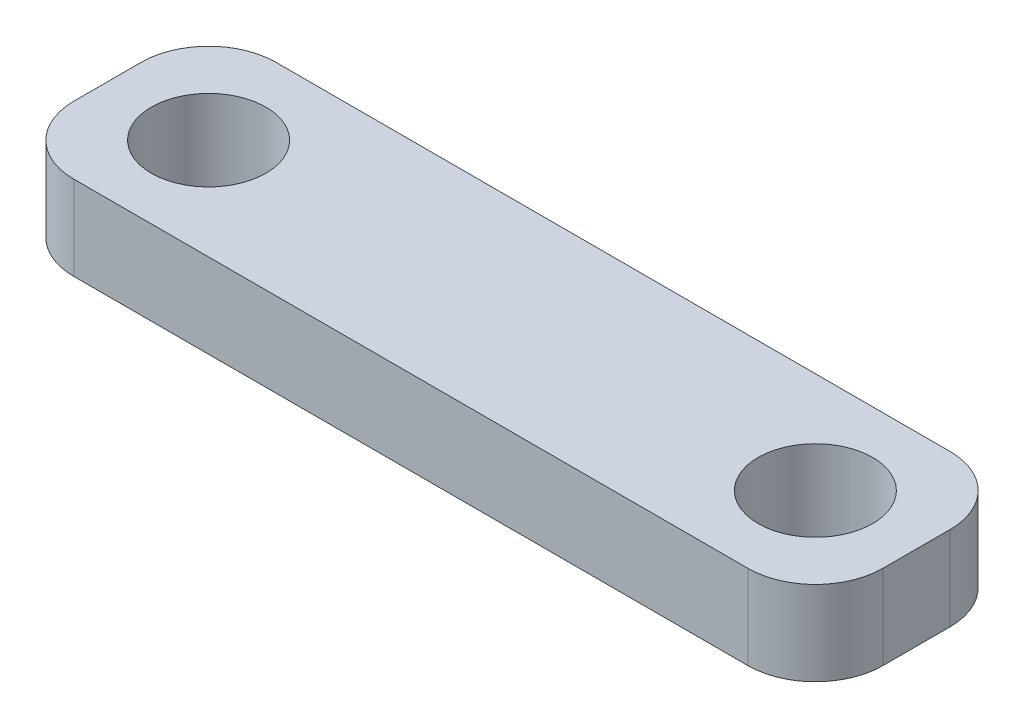
from build123d import *

# Parameters (mm, degrees)
SKETCH_1_R      = 1.7
EXTRUDE_1_DEPTH = 2.5


with BuildPart() as part:
    # 草图1 → 凸台-拉伸1 (new body)
    with BuildSketch(Plane(origin=(0, 0, 0), x_dir=(1, 0, 0), z_dir=(0, 1, 0))):
        with BuildLine():
            Line((-10, 3), (10, 3))
            ThreePointArc((10, 3), (11.414213562, 2.414213562), (12, 1))
            Line((12, 1), (12, -1))
            ThreePointArc((12, -1), (11.414213562, -2.414213562), (10, -3))
            Line((10, -3), (-10, -3))
            ThreePointArc((-10, -3), (-11.414213562, -2.414213562), (-12, -1))
            Line((-12, -1), (-12, 1))
            ThreePointArc((-12, 1), (-11.414213562, 2.414213562), (-10, 3))
        make_face()
        with Locations(Location((-9, 0, 0), (0, 0, 270))):
            Circle(SKETCH_1_R, mode=Mode.SUBTRACT)
        with Locations(Location((9, 0, 0), (0, 0, 270))):
            Circle(SKETCH_1_R, mode=Mode.SUBTRACT)
    extrude(amount=EXTRUDE_1_DEPTH)


solid = part.part
